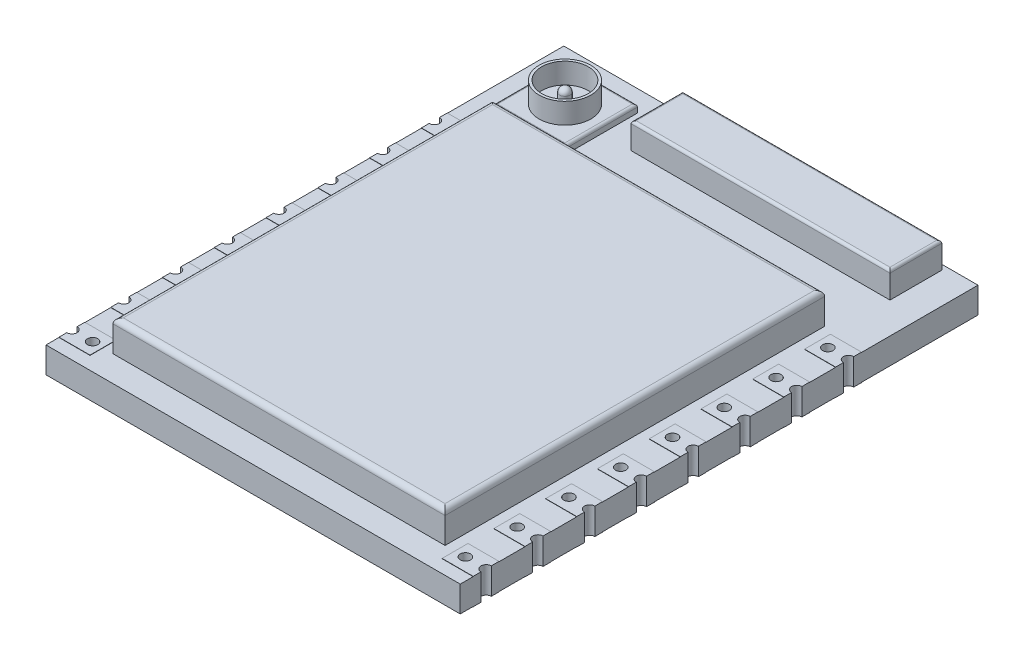
from build123d import *

# Parameters (mm, degrees)
SKETCH1_W                = 16
SKETCH1_H                = 20
BOSS_EXTRUDE1_DEPTH      = 1
SKETCH2_R                = 0.2
CUT_EXTRUDE9_DEPTH       = 1
BOSS_EXTRUDE2_DEPTH      = 0.01
BOSS_EXTRUDE2_DEPTH_BACK = 1.01
SKETCH2_4_R              = 0.2
SKETCH3_W                = 10
SKETCH3_H                = 2
BOSS_EXTRUDE3_DEPTH      = 1
SKETCH4_W                = 2.8
SKETCH4_H                = 2.8
BOSS_EXTRUDE4_DEPTH      = 0.3
FILLET1_R                = 0.1
SKETCH5_R                = 1
SKETCH5_R_2              = 0.9
BOSS_EXTRUDE5_DEPTH      = 0.8
SKETCH6_R                = 0.2
BOSS_EXTRUDE6_DEPTH      = 0.6
FILLET2_R                = 0.2
SKETCH8_W                = 12.829572786
SKETCH8_H                = 14.663739525
BOSS_EXTRUDE7_DEPTH      = 1.2
FILLET3_R                = 0.2


with BuildPart() as part:
    # Sketch1 → Boss-Extrude1 (new body)
    with BuildSketch(Plane(origin=(0, 0, 0), x_dir=(1, 0, 0), z_dir=(0, 1, 0))):
        Rectangle(SKETCH1_W, SKETCH1_H)
    extrude(amount=BOSS_EXTRUDE1_DEPTH)

    # Sketch2 → Cut-Extrude9 (cut)
    with BuildSketch(Plane(origin=(0, 1, 0), x_dir=(1, 0, 0), z_dir=(0, 1, 0))):
        with BuildLine():
            Line((-8, 5.2), (-8, 5))
            Line((-8, 5), (-8, 4.8))
            ThreePointArc((-8, 4.8), (-7.8, 5), (-8, 5.2))
        make_face()
        with Locations(Location((-7.2, 5, 0), (0, 0, 270))):
            Circle(SKETCH2_R)
        with Locations(Location((-7.2, 3, 0), (0, 0, 270))):
            Circle(SKETCH2_R)
        with BuildLine():
            ThreePointArc((-8, 2.8), (-7.8, 3), (-8, 3.2))
            Line((-8, 3.2), (-8, 3))
            Line((-8, 3), (-8, 2.8))
        make_face()
        with Locations(Location((-7.2, 1, 0), (0, 0, 270))):
            Circle(SKETCH2_R)
        with BuildLine():
            ThreePointArc((-8, 0.8), (-7.8, 1), (-8, 1.2))
            Line((-8, 1.2), (-8, 1))
            Line((-8, 1), (-8, 0.8))
        make_face()
        with Locations(Location((-7.2, -1, 0), (0, 0, 270))):
            Circle(SKETCH2_R)
        with BuildLine():
            ThreePointArc((-8, -1.2), (-7.8, -1), (-8, -0.8))
            Line((-8, -0.8), (-8, -1))
            Line((-8, -1), (-8, -1.2))
        make_face()
        with Locations(Location((-7.2, -3, 0), (0, 0, 270))):
            Circle(SKETCH2_R)
        with BuildLine():
            ThreePointArc((-8, -3.2), (-7.8, -3), (-8, -2.8))
            Line((-8, -2.8), (-8, -3))
            Line((-8, -3), (-8, -3.2))
        make_face()
        with Locations(Location((-7.2, -5, 0), (0, 0, 270))):
            Circle(SKETCH2_R)
        with BuildLine():
            ThreePointArc((-8, -5.2), (-7.8, -5), (-8, -4.8))
            Line((-8, -4.8), (-8, -5))
            Line((-8, -5), (-8, -5.2))
        make_face()
        with Locations(Location((-7.2, -7, 0), (0, 0, 270))):
            Circle(SKETCH2_R)
        with BuildLine():
            ThreePointArc((-8, -7.2), (-7.8, -7), (-8, -6.8))
            Line((-8, -6.8), (-8, -7))
            Line((-8, -7), (-8, -7.2))
        make_face()
        with Locations(Location((-7.2, -9, 0), (0, 0, 270))):
            Circle(SKETCH2_R)
        with BuildLine():
            ThreePointArc((-8, -9.2), (-7.8, -9), (-8, -8.8))
            Line((-8, -8.8), (-8, -9))
            Line((-8, -9), (-8, -9.2))
        make_face()
        with BuildLine():
            ThreePointArc((8, -8.8), (7.8, -9), (8, -9.2))
            Line((8, -9.2), (8, -9))
            Line((8, -9), (8, -8.8))
        make_face()
        with Locations(Location((7.2, -9, 0), (0, 0, 270))):
            Circle(SKETCH2_R)
        with Locations(Location((7.2, -7, 0), (0, 0, 270))):
            Circle(SKETCH2_R)
        with BuildLine():
            ThreePointArc((8, -6.8), (7.8, -7), (8, -7.2))
            Line((8, -7.2), (8, -7))
            Line((8, -7), (8, -6.8))
        make_face()
        with Locations(Location((7.2, -3, 0), (0, 0, 270))):
            Circle(SKETCH2_R)
        with BuildLine():
            ThreePointArc((8, -2.8), (7.8, -3), (8, -3.2))
            Line((8, -3.2), (8, -3))
            Line((8, -3), (8, -2.8))
        make_face()
        with BuildLine():
            ThreePointArc((8, -4.8), (7.8, -5), (8, -5.2))
            Line((8, -5.2), (8, -5))
            Line((8, -5), (8, -4.8))
        make_face()
        with Locations(Location((7.2, -5, 0), (0, 0, 270))):
            Circle(SKETCH2_R)
        with Locations(Location((7.2, 1, 0), (0, 0, 270))):
            Circle(SKETCH2_R)
        with BuildLine():
            ThreePointArc((8, 1.2), (7.8, 1), (8, 0.8))
            Line((8, 0.8), (8, 1))
            Line((8, 1), (8, 1.2))
        make_face()
        with BuildLine():
            ThreePointArc((8, -0.8), (7.8, -1), (8, -1.2))
            Line((8, -1.2), (8, -1))
            Line((8, -1), (8, -0.8))
        make_face()
        with Locations(Location((7.2, -1, 0), (0, 0, 270))):
            Circle(SKETCH2_R)
        with Locations(Location((7.2, 5, 0), (0, 0, 270))):
            Circle(SKETCH2_R)
        with BuildLine():
            ThreePointArc((8, 5.2), (7.8, 5), (8, 4.8))
            Line((8, 4.8), (8, 5))
            Line((8, 5), (8, 5.2))
        make_face()
        with BuildLine():
            ThreePointArc((8, 3.2), (7.8, 3), (8, 2.8))
            Line((8, 2.8), (8, 3))
            Line((8, 3), (8, 3.2))
        make_face()
        with Locations(Location((7.2, 3, 0), (0, 0, 270))):
            Circle(SKETCH2_R)
    extrude(amount=-CUT_EXTRUDE9_DEPTH, mode=Mode.SUBTRACT)

    # Sketch2<4> → Boss-Extrude2 (add, two sides: drawn at the far end of the back side and taken through both)
    # profile 1 of 16: a face of its own
    with BuildSketch(Plane(origin=(0, 1, 0), x_dir=(1, 0, 0), z_dir=(0, 1, 0)).offset(-BOSS_EXTRUDE2_DEPTH_BACK)):
        with BuildLine():
            Line((-8, 5.5), (-8, 5.2))
            ThreePointArc((-8, 5.2), (-7.8, 5), (-8, 4.8))
            Line((-8, 4.8), (-8, 4.5))
            Line((-8, 4.5), (-6.8, 4.5))
            Line((-6.8, 4.5), (-6.8, 5.5))
            Line((-6.8, 5.5), (-8, 5.5))
        make_face()
        with Locations(Location((-7.2, 5, 0), (0, 0, 270))):
            Circle(SKETCH2_4_R, mode=Mode.SUBTRACT)
    # profile 2 of 16: a face of its own
    with BuildSketch(Plane(origin=(0, 1, 0), x_dir=(1, 0, 0), z_dir=(0, 1, 0)).offset(-BOSS_EXTRUDE2_DEPTH_BACK)):
        with BuildLine():
            Line((-6.8, 3.5), (-8, 3.5))
            Line((-8, 3.5), (-8, 3.2))
            ThreePointArc((-8, 3.2), (-7.8, 3), (-8, 2.8))
            Line((-8, 2.8), (-8, 2.5))
            Line((-8, 2.5), (-6.8, 2.5))
            Line((-6.8, 2.5), (-6.8, 3.5))
        make_face()
        with Locations(Location((-7.2, 3, 0), (0, 0, 270))):
            Circle(SKETCH2_4_R, mode=Mode.SUBTRACT)
    # profile 3 of 16: a face of its own
    with BuildSketch(Plane(origin=(0, 1, 0), x_dir=(1, 0, 0), z_dir=(0, 1, 0)).offset(-BOSS_EXTRUDE2_DEPTH_BACK)):
        with BuildLine():
            Line((-6.8, 1.5), (-8, 1.5))
            Line((-8, 1.5), (-8, 1.2))
            ThreePointArc((-8, 1.2), (-7.8, 1), (-8, 0.8))
            Line((-8, 0.8), (-8, 0.5))
            Line((-8, 0.5), (-6.8, 0.5))
            Line((-6.8, 0.5), (-6.8, 1.5))
        make_face()
        with Locations(Location((-7.2, 1, 0), (0, 0, 270))):
            Circle(SKETCH2_4_R, mode=Mode.SUBTRACT)
    # profile 4 of 16: a face of its own
    with BuildSketch(Plane(origin=(0, 1, 0), x_dir=(1, 0, 0), z_dir=(0, 1, 0)).offset(-BOSS_EXTRUDE2_DEPTH_BACK)):
        with BuildLine():
            Line((-6.8, -0.5), (-8, -0.5))
            Line((-8, -0.5), (-8, -0.8))
            ThreePointArc((-8, -0.8), (-7.8, -1), (-8, -1.2))
            Line((-8, -1.2), (-8, -1.5))
            Line((-8, -1.5), (-6.8, -1.5))
            Line((-6.8, -1.5), (-6.8, -0.5))
        make_face()
        with Locations(Location((-7.2, -1, 0), (0, 0, 270))):
            Circle(SKETCH2_4_R, mode=Mode.SUBTRACT)
    # profile 5 of 16: a face of its own
    with BuildSketch(Plane(origin=(0, 1, 0), x_dir=(1, 0, 0), z_dir=(0, 1, 0)).offset(-BOSS_EXTRUDE2_DEPTH_BACK)):
        with BuildLine():
            Line((-6.8, -2.5), (-8, -2.5))
            Line((-8, -2.5), (-8, -2.8))
            ThreePointArc((-8, -2.8), (-7.8, -3), (-8, -3.2))
            Line((-8, -3.2), (-8, -3.5))
            Line((-8, -3.5), (-6.8, -3.5))
            Line((-6.8, -3.5), (-6.8, -2.5))
        make_face()
        with Locations(Location((-7.2, -3, 0), (0, 0, 270))):
            Circle(SKETCH2_4_R, mode=Mode.SUBTRACT)
    # profile 6 of 16: a face of its own
    with BuildSketch(Plane(origin=(0, 1, 0), x_dir=(1, 0, 0), z_dir=(0, 1, 0)).offset(-BOSS_EXTRUDE2_DEPTH_BACK)):
        with BuildLine():
            Line((6.8, -9.5), (8, -9.5))
            Line((8, -9.5), (8, -9.2))
            ThreePointArc((8, -9.2), (7.8, -9), (8, -8.8))
            Line((8, -8.8), (8, -8.5))
            Line((8, -8.5), (6.8, -8.5))
            Line((6.8, -8.5), (6.8, -9.5))
        make_face()
        with Locations(Location((7.2, -9, 0), (0, 0, 270))):
            Circle(SKETCH2_4_R, mode=Mode.SUBTRACT)
    # profile 7 of 16: a face of its own
    with BuildSketch(Plane(origin=(0, 1, 0), x_dir=(1, 0, 0), z_dir=(0, 1, 0)).offset(-BOSS_EXTRUDE2_DEPTH_BACK)):
        with BuildLine():
            Line((6.8, -7.5), (8, -7.5))
            Line((8, -7.5), (8, -7.2))
            ThreePointArc((8, -7.2), (7.8, -7), (8, -6.8))
            Line((8, -6.8), (8, -6.5))
            Line((8, -6.5), (6.8, -6.5))
            Line((6.8, -6.5), (6.8, -7.5))
        make_face()
        with Locations(Location((7.2, -7, 0), (0, 0, 270))):
            Circle(SKETCH2_4_R, mode=Mode.SUBTRACT)
    # profile 8 of 16: a face of its own
    with BuildSketch(Plane(origin=(0, 1, 0), x_dir=(1, 0, 0), z_dir=(0, 1, 0)).offset(-BOSS_EXTRUDE2_DEPTH_BACK)):
        with BuildLine():
            Line((6.8, -5.5), (8, -5.5))
            Line((8, -5.5), (8, -5.2))
            ThreePointArc((8, -5.2), (7.8, -5), (8, -4.8))
            Line((8, -4.8), (8, -4.5))
            Line((8, -4.5), (6.8, -4.5))
            Line((6.8, -4.5), (6.8, -5.5))
        make_face()
        with Locations(Location((7.2, -5, 0), (0, 0, 270))):
            Circle(SKETCH2_4_R, mode=Mode.SUBTRACT)
    # profile 9 of 16: a face of its own
    with BuildSketch(Plane(origin=(0, 1, 0), x_dir=(1, 0, 0), z_dir=(0, 1, 0)).offset(-BOSS_EXTRUDE2_DEPTH_BACK)):
        with BuildLine():
            Line((6.8, -3.5), (8, -3.5))
            Line((8, -3.5), (8, -3.2))
            ThreePointArc((8, -3.2), (7.8, -3), (8, -2.8))
            Line((8, -2.8), (8, -2.5))
            Line((8, -2.5), (6.8, -2.5))
            Line((6.8, -2.5), (6.8, -3.5))
        make_face()
        with Locations(Location((7.2, -3, 0), (0, 0, 270))):
            Circle(SKETCH2_4_R, mode=Mode.SUBTRACT)
    # profile 10 of 16: a face of its own
    with BuildSketch(Plane(origin=(0, 1, 0), x_dir=(1, 0, 0), z_dir=(0, 1, 0)).offset(-BOSS_EXTRUDE2_DEPTH_BACK)):
        with BuildLine():
            Line((6.8, -1.5), (8, -1.5))
            Line((8, -1.5), (8, -1.2))
            ThreePointArc((8, -1.2), (7.8, -1), (8, -0.8))
            Line((8, -0.8), (8, -0.5))
            Line((8, -0.5), (6.8, -0.5))
            Line((6.8, -0.5), (6.8, -1.5))
        make_face()
        with Locations(Location((7.2, -1, 0), (0, 0, 270))):
            Circle(SKETCH2_4_R, mode=Mode.SUBTRACT)
    # profile 11 of 16: a face of its own
    with BuildSketch(Plane(origin=(0, 1, 0), x_dir=(1, 0, 0), z_dir=(0, 1, 0)).offset(-BOSS_EXTRUDE2_DEPTH_BACK)):
        with BuildLine():
            Line((6.8, 0.5), (8, 0.5))
            Line((8, 0.5), (8, 0.8))
            ThreePointArc((8, 0.8), (7.8, 1), (8, 1.2))
            Line((8, 1.2), (8, 1.5))
            Line((8, 1.5), (6.8, 1.5))
            Line((6.8, 1.5), (6.8, 0.5))
        make_face()
        with Locations(Location((7.2, 1, 0), (0, 0, 270))):
            Circle(SKETCH2_4_R, mode=Mode.SUBTRACT)
    # profile 12 of 16: a face of its own
    with BuildSketch(Plane(origin=(0, 1, 0), x_dir=(1, 0, 0), z_dir=(0, 1, 0)).offset(-BOSS_EXTRUDE2_DEPTH_BACK)):
        with BuildLine():
            Line((6.8, 2.5), (8, 2.5))
            Line((8, 2.5), (8, 2.8))
            ThreePointArc((8, 2.8), (7.8, 3), (8, 3.2))
            Line((8, 3.2), (8, 3.5))
            Line((8, 3.5), (6.8, 3.5))
            Line((6.8, 3.5), (6.8, 2.5))
        make_face()
        with Locations(Location((7.2, 3, 0), (0, 0, 270))):
            Circle(SKETCH2_4_R, mode=Mode.SUBTRACT)
    # profile 13 of 16: a face of its own
    with BuildSketch(Plane(origin=(0, 1, 0), x_dir=(1, 0, 0), z_dir=(0, 1, 0)).offset(-BOSS_EXTRUDE2_DEPTH_BACK)):
        with BuildLine():
            Line((6.8, 4.5), (8, 4.5))
            Line((8, 4.5), (8, 4.8))
            ThreePointArc((8, 4.8), (7.8, 5), (8, 5.2))
            Line((8, 5.2), (8, 5.5))
            Line((8, 5.5), (6.8, 5.5))
            Line((6.8, 5.5), (6.8, 4.5))
        make_face()
        with Locations(Location((7.2, 5, 0), (0, 0, 270))):
            Circle(SKETCH2_4_R, mode=Mode.SUBTRACT)
    # profile 14 of 16: a face of its own
    with BuildSketch(Plane(origin=(0, 1, 0), x_dir=(1, 0, 0), z_dir=(0, 1, 0)).offset(-BOSS_EXTRUDE2_DEPTH_BACK)):
        with BuildLine():
            Line((-6.8, -4.5), (-8, -4.5))
            Line((-8, -4.5), (-8, -4.8))
            ThreePointArc((-8, -4.8), (-7.8, -5), (-8, -5.2))
            Line((-8, -5.2), (-8, -5.5))
            Line((-8, -5.5), (-6.8, -5.5))
            Line((-6.8, -5.5), (-6.8, -4.5))
        make_face()
        with Locations(Location((-7.2, -5, 0), (0, 0, 270))):
            Circle(SKETCH2_4_R, mode=Mode.SUBTRACT)
    # profile 15 of 16: a face of its own
    with BuildSketch(Plane(origin=(0, 1, 0), x_dir=(1, 0, 0), z_dir=(0, 1, 0)).offset(-BOSS_EXTRUDE2_DEPTH_BACK)):
        with BuildLine():
            Line((-6.8, -6.5), (-8, -6.5))
            Line((-8, -6.5), (-8, -6.8))
            ThreePointArc((-8, -6.8), (-7.8, -7), (-8, -7.2))
            Line((-8, -7.2), (-8, -7.5))
            Line((-8, -7.5), (-6.8, -7.5))
            Line((-6.8, -7.5), (-6.8, -6.5))
        make_face()
        with Locations(Location((-7.2, -7, 0), (0, 0, 270))):
            Circle(SKETCH2_4_R, mode=Mode.SUBTRACT)
    # profile 16 of 16: a face of its own
    with BuildSketch(Plane(origin=(0, 1, 0), x_dir=(1, 0, 0), z_dir=(0, 1, 0)).offset(-BOSS_EXTRUDE2_DEPTH_BACK)):
        with BuildLine():
            Line((-6.8, -8.5), (-8, -8.5))
            Line((-8, -8.5), (-8, -8.8))
            ThreePointArc((-8, -8.8), (-7.8, -9), (-8, -9.2))
            Line((-8, -9.2), (-8, -9.5))
            Line((-8, -9.5), (-6.8, -9.5))
            Line((-6.8, -9.5), (-6.8, -8.5))
        make_face()
        with Locations(Location((-7.2, -9, 0), (0, 0, 270))):
            Circle(SKETCH2_4_R, mode=Mode.SUBTRACT)
    extrude(amount=BOSS_EXTRUDE2_DEPTH + BOSS_EXTRUDE2_DEPTH_BACK)

    # Sketch3 → Boss-Extrude3 (add)
    with BuildSketch(Plane(origin=(0, 1, 0), x_dir=(1, 0, 0), z_dir=(0, 1, 0))):
        with Locations((1.8, 8.8)):
            Rectangle(SKETCH3_W, SKETCH3_H)
    extrude(amount=BOSS_EXTRUDE3_DEPTH)

    # Sketch4 → Boss-Extrude4 (add)
    with BuildSketch(Plane(origin=(0, 1, 0), x_dir=(1, 0, 0), z_dir=(0, 1, 0))):
        with Locations((-5.734813437, 7.780344812)):
            Rectangle(SKETCH4_W, SKETCH4_H)
    extrude(amount=BOSS_EXTRUDE4_DEPTH)

    # Fillet1
    fillet1_edges = [part.edges().sort_by_distance(p)[0] for p in [
        (-3.2, 2, -8.8),
        (1.8, 2, -7.8),
        (6.8, 2, -8.8),
        (1.8, 2, -9.8),
        (-7.134813437, 1.3, -7.780344812),
        (-5.734813437, 1.3, -6.380344812),
        (-4.334813437, 1.3, -7.780344812),
        (-5.734813437, 1.3, -9.180344812),
    ]]
    fillet(fillet1_edges, radius=FILLET1_R)

    # Sketch5 → Boss-Extrude5 (add)
    with BuildSketch(Plane(origin=(0, 1.3, 0), x_dir=(1, 0, 0), z_dir=(0, 1, 0))):
        with Locations(Location((-5.734813437, 7.780344812, 0), (0, 0, 270))):
            Circle(SKETCH5_R)
        with Locations(Location((-5.734813437, 7.780344812, 0), (0, 0, 270))):
            Circle(SKETCH5_R_2, mode=Mode.SUBTRACT)
    extrude(amount=BOSS_EXTRUDE5_DEPTH)

    # Sketch6 → Boss-Extrude6 (add)
    with BuildSketch(Plane(origin=(0, 1.3, 0), x_dir=(1, 0, 0), z_dir=(0, 1, 0))):
        with Locations(Location((-5.734813437, 7.780344812, 0), (0, 0, 270))):
            Circle(SKETCH6_R)
    extrude(amount=BOSS_EXTRUDE6_DEPTH)

    # Fillet2
    fillet2_edges = [part.edges().sort_by_distance(p)[0] for p in [
        (-5.734813437, 1.9, -7.980344812),
    ]]
    fillet(fillet2_edges, radius=FILLET2_R)

    # Sketch8 → Boss-Extrude7 (add)
    with BuildSketch(Plane(origin=(0, 1, 0), x_dir=(1, 0, 0), z_dir=(0, 1, 0))):
        with Locations((0, -1.668130237)):
            Rectangle(SKETCH8_W, SKETCH8_H)
    extrude(amount=BOSS_EXTRUDE7_DEPTH)

    # Fillet3
    fillet3_edges = [part.edges().sort_by_distance(p)[0] for p in [
        (-6.414786393, 2.2, 1.668130237),
        (0, 2.2, 9),
        (6.414786393, 2.2, 1.668130237),
        (0, 2.2, -5.663739525),
    ]]
    fillet(fillet3_edges, radius=FILLET3_R)


solid = part.part
